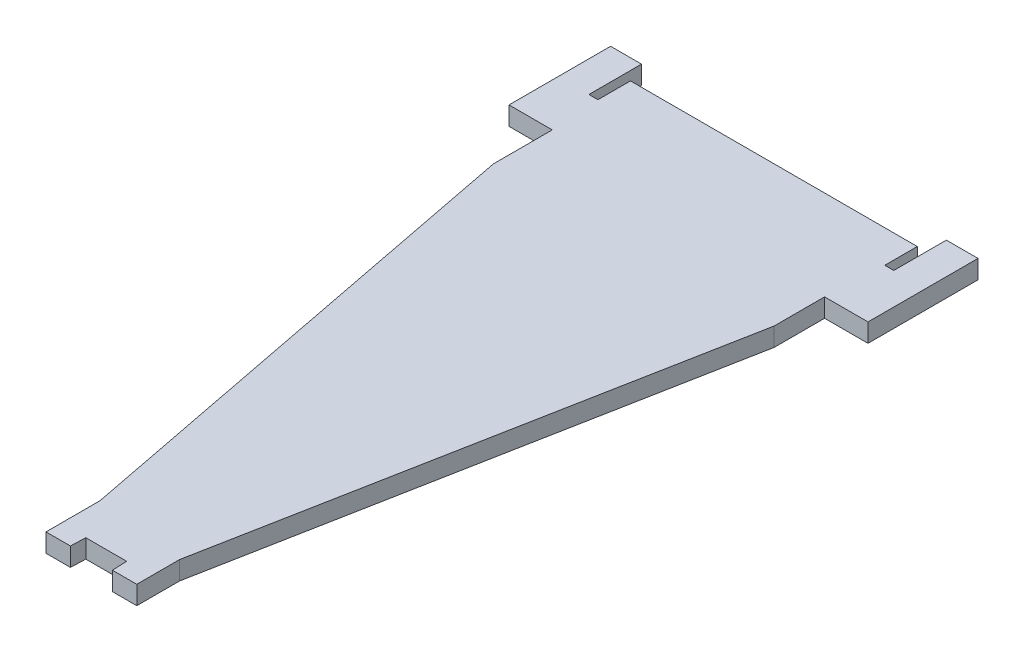
from build123d import *

# Parameters (mm, degrees)
BOSS_EXTRUDE1_DEPTH = 0.35


with BuildPart() as part:
    # Sketch1 → Boss-Extrude1 (new body)
    with BuildSketch(Plane(origin=(0, 0, 0), x_dir=(1, 0, 0), z_dir=(0, 1, 0))):
        Polygon((65.771104466, 123.588230372), (67.561104466, 132.998516086), (67.561104466, 133.949859164), (68.378580887, 133.949859164), (68.378580887, 136.022566648), (67.782425522, 136.022566648), (67.782425522, 135.031947544), (67.612425522, 135.031947544), (67.612425522, 135.644718334), (62.208580887, 135.644718334), (62.208580887, 135.031947544), (62.038580887, 135.031947544), (62.038580887, 136.022566648), (61.456203144, 136.022566648), (61.456203144, 134.108516086), (62.271104466, 134.108516086), (62.271104466, 132.998516086), (64.061104466, 123.798516086), (64.061104466, 122.780144879), (64.521104466, 122.780144879), (64.531104466, 123.060144879), (65.301104466, 123.060144879), (65.311104466, 122.780144879), (65.771104466, 122.780144879), align=None)
    extrude(amount=BOSS_EXTRUDE1_DEPTH)


solid = part.part
